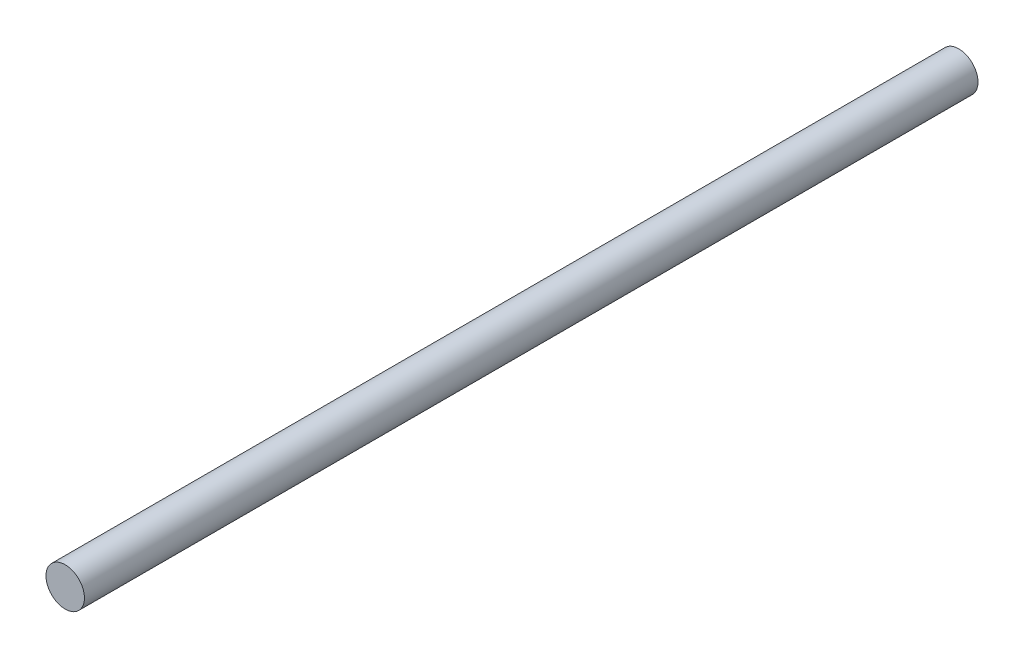
from build123d import *

# Parameters (mm, degrees)
SKETCH2_R           = 55
SKETCH2_R_2         = 53
BOSS_EXTRUDE1_DEPTH = 2500
SKETCH3_R           = 55
BOSS_EXTRUDE2_DEPTH = 55


with BuildPart() as part:
    # Sketch2 → Boss-Extrude1 (new body)
    with BuildSketch(Plane.XY.offset(70)):
        Circle(SKETCH2_R)
        Circle(SKETCH2_R_2, mode=Mode.SUBTRACT)
    extrude(amount=BOSS_EXTRUDE1_DEPTH)

    # Sketch3 → Boss-Extrude2 (add)
    with BuildSketch(Plane.XY.offset(2570)):
        Circle(SKETCH3_R)
    extrude(amount=BOSS_EXTRUDE2_DEPTH)


solid = part.part
